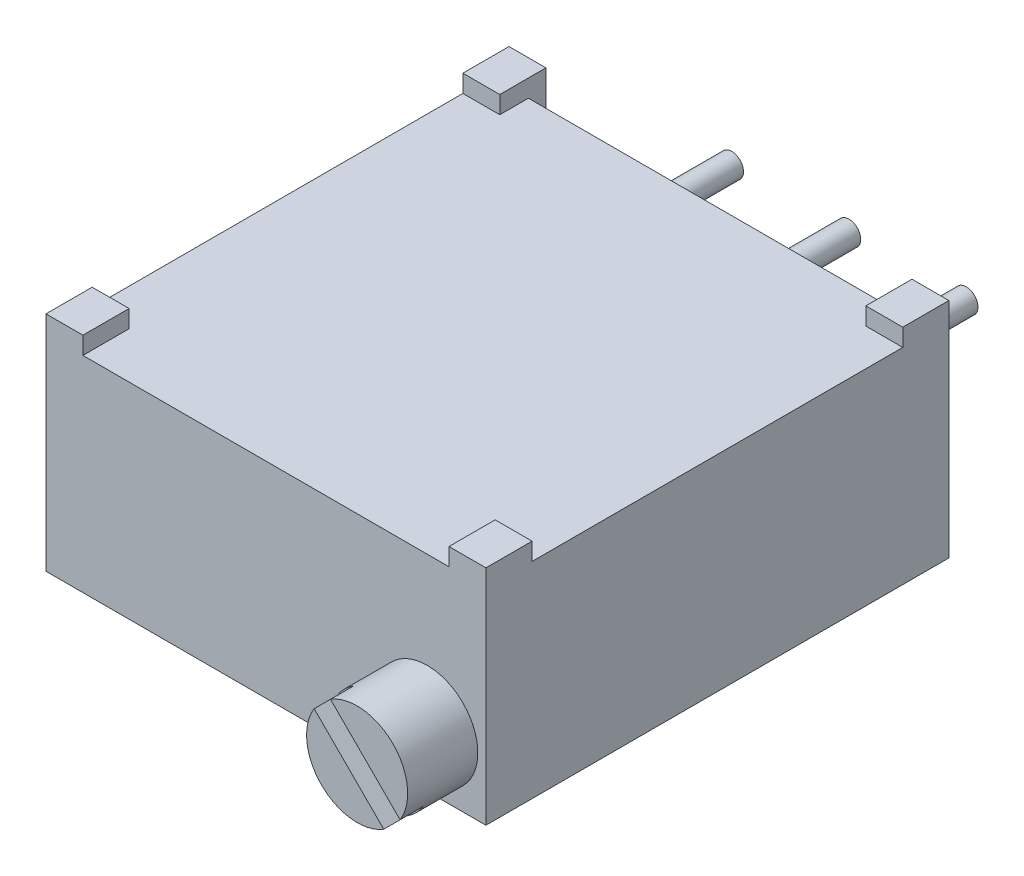
from build123d import *

# Parameters (mm, degrees)
ESBO_O1_W                = 9.53
ESBO_O1_H                = 10.03
RESSALTO_EXTRUS_O1_DEPTH = 2.415
CORTE_EXTRUS_O1_REACH    = 14.109
ESBO_O2_W                = 7.93
ESBO_O2_H                = 1
CORTE_EXTRUS_O2_DEPTH    = 0.38
ESBO_O4_R                = 1.095
RESSALTO_EXTRUS_O2_DEPTH = 1.52
CORTE_EXTRUS_O3_START    = -0.5
CORTE_EXTRUS_O3_DEPTH    = 0.5
ESBO_O6_R                = 0.255
RESSALTO_EXTRUS_O3_DEPTH = 2.98


with BuildPart() as part:
    # Esboço1 → Ressalto-extrusão1 (new, symmetric)
    with BuildSketch(Plane(origin=(0, 0, 0), x_dir=(1, 0, 0), z_dir=(0, 1, 0))):
        with Locations((0, -5.015)):
            Rectangle(ESBO_O1_W, ESBO_O1_H)
    extrude(amount=RESSALTO_EXTRUS_O1_DEPTH, both=True)

    # Esboço2 → Corte-extrusão1 (cut, up to next)
    with BuildSketch(Plane(origin=(0, -2.415, 0), x_dir=(-1, 0, 0), z_dir=(0, -1, 0)), mode=Mode.PRIVATE) as corte_extrus_o1_sk1:
        with Locations((0, 0.12)):
            Rectangle(ESBO_O2_W, ESBO_O2_H)
    corte_extrus_o1_tool1 = extrude(corte_extrus_o1_sk1.sketch, amount=-CORTE_EXTRUS_O1_REACH, mode=Mode.PRIVATE) & part.part
    add(corte_extrus_o1_tool1.solids().sort_by_distance((0, -2.415, -0.12))[0], mode=Mode.SUBTRACT)

    # Esboço3 → Corte-extrusão2 (cut)
    with BuildSketch(Plane(origin=(0, 2.415, 0), x_dir=(1, 0, 0), z_dir=(0, 1, 0))):
        Polygon((3.965, -0.38), (-3.965, -0.38), (-3.965, -1), (-4.765, -1), (-4.765, -9.03), (-3.965, -9.03), (-3.965, -10.03), (3.965, -10.03), (3.965, -9.03), (4.765, -9.03), (4.765, -1), (3.965, -1), align=None)
    extrude(amount=-CORTE_EXTRUS_O2_DEPTH, mode=Mode.SUBTRACT)

    # Esboço4 → Ressalto-extrusão2 (add)
    with BuildSketch(Plane.XY.offset(10.03)):
        with Locations(Location((3.495, -1.145, 0), (0, 0, 180))):
            Circle(ESBO_O4_R)
    extrude(amount=RESSALTO_EXTRUS_O2_DEPTH)

    # Esboço5 → Corte-extrusão3 (cut)
    with BuildSketch(Plane.XY.offset(11.55).offset(CORTE_EXTRUS_O3_START)):
        with BuildLine():
            Line((2.917944817, -0.214391427), (4.425608573, -1.722055183))
            ThreePointArc((4.425608573, -1.722055183), (4.269281925, -1.919281925), (4.072055183, -2.075608573))
            Line((4.072055183, -2.075608573), (2.564391427, -0.567944817))
            ThreePointArc((2.564391427, -0.567944817), (2.720718075, -0.370718075), (2.917944817, -0.214391427))
        make_face()
    extrude(amount=CORTE_EXTRUS_O3_DEPTH, mode=Mode.SUBTRACT)

    # Esboço6 → Ressalto-extrusão3 (add)
    with BuildSketch(Plane(origin=(0, 0, 0.38), x_dir=(-1, 0, 0), z_dir=(0, 0, -1))):
        with Locations(Location((0, 0.005, 0), (0, 0, 180))):
            Circle(ESBO_O6_R)
        with Locations(Location((-2.54, 0.005, 0), (0, 0, 180))):
            Circle(ESBO_O6_R)
        with Locations(Location((2.54, 0.005, 0), (0, 0, 180))):
            Circle(ESBO_O6_R)
    extrude(amount=RESSALTO_EXTRUS_O3_DEPTH)


solid = part.part
